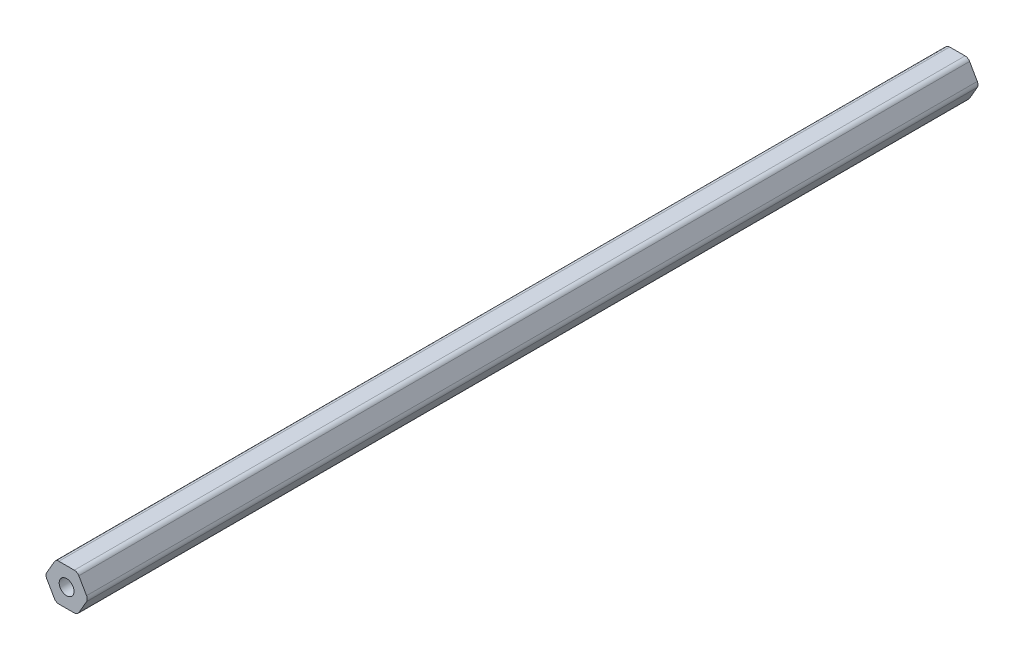
from build123d import *

# Parameters (mm, degrees)
SKETCH1_R           = 2.54
BOSS_EXTRUDE1_DEPTH = 304.8
FILLET1_R           = 1.778


with BuildPart() as part:
    # Sketch1 → Boss-Extrude1 (new body)
    with BuildSketch(Plane.XY):
        Polygon((6.708318766, 2.691127877), (3.042144557, 9.041127877), (-4.290203862, 9.041127877), (-7.956378071, 2.691127877), (-4.290203862, -3.658872123), (3.042144557, -3.658872123), align=None)
        with Locations(Location((-0.624029653, 2.691127877, 0), (0, 0, 180))):
            Circle(SKETCH1_R, mode=Mode.SUBTRACT)
    extrude(amount=BOSS_EXTRUDE1_DEPTH)

    # Fillet1
    fillet1_edges = [part.edges().sort_by_distance(p)[0] for p in [
        (3.042144557, -3.658872123, 152.4),
        (-4.290203862, -3.658872123, 152.4),
        (-7.956378071, 2.691127877, 152.4),
        (-4.290203862, 9.041127877, 152.4),
        (3.042144557, 9.041127877, 152.4),
        (6.708318766, 2.691127877, 152.4),
    ]]
    fillet(fillet1_edges, radius=FILLET1_R)


solid = part.part
